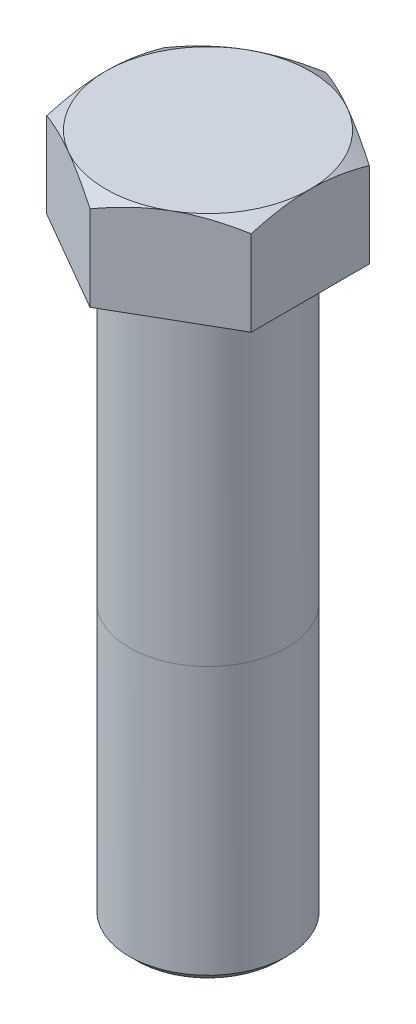
from build123d import *

# Parameters (mm, degrees)
BOSS_EXTRUDE1_DEPTH = 12
SKETCH2_OUTSIDE_W   = 77.868
SKETCH2_OUTSIDE_H   = 81.89
SKETCH2_OUTSIDE_R   = 13
CUT_EXTRUDE2_DEPTH  = 12
CUT_EXTRUDE2_DRAFT  = -60
SKETCH3_R           = 10
BOSS_EXTRUDE2_DEPTH = 75
CHAMFER1_SIZE       = 1


with BuildPart() as part:
    # Sketch1 → Boss-Extrude1 (new body)
    with BuildSketch(Plane(origin=(0, 0, 0), x_dir=(1, 0, 0), z_dir=(0, 1, 0))):
        Polygon((13, 7.505553499), (0, 15.011106999), (-13, 7.505553499), (-13, -7.505553499), (0, -15.011106999), (13, -7.505553499), align=None)
    extrude(amount=BOSS_EXTRUDE1_DEPTH)


with BuildPart() as cut_extrude2_tool:
    # Sketch2 outside → Cut-Extrude2 (with draft: the straight prism first)
    with BuildSketch(Plane(origin=(0, 12, 0), x_dir=(1, 0, 0), z_dir=(0, 1, 0))):
        Rectangle(SKETCH2_OUTSIDE_W, SKETCH2_OUTSIDE_H)
        Circle(SKETCH2_OUTSIDE_R, mode=Mode.SUBTRACT)
    extrude(amount=-CUT_EXTRUDE2_DEPTH)
    # Cut-Extrude2: the draft: its side faces are tilted about the plane it starts from
    cut_extrude2_sides = [cut_extrude2_tool.faces().sort_by_distance(p)[0] for p in [
        (0, 6, 40.945),
        (38.934, 6, 0),
        (0, 6, -40.945),
        (-38.934, 6, 0),
        (-13, 6, 0),
    ]]
    draft(cut_extrude2_sides, Plane(origin=(0, 12, 0), x_dir=(1, 0, 0), z_dir=(0, 1, 0)), CUT_EXTRUDE2_DRAFT)


with BuildPart() as part_1:
    add(part.part)

    # Cut-Extrude2: cut by cut_extrude2_tool
    add(cut_extrude2_tool.part, mode=Mode.SUBTRACT)

    # Sketch3 → Boss-Extrude2 (add)
    with BuildSketch(Plane.XZ):
        with Locations(Location((0, 0, 0), (0, 0, 90))):
            Circle(SKETCH3_R)
    extrude(amount=BOSS_EXTRUDE2_DEPTH)

    # Chamfer1
    chamfer1_edges = [part_1.edges().sort_by_distance(p)[0] for p in [
        (0, -75, -10),
    ]]
    chamfer(chamfer1_edges, length=CHAMFER1_SIZE)


solid = part_1.part
